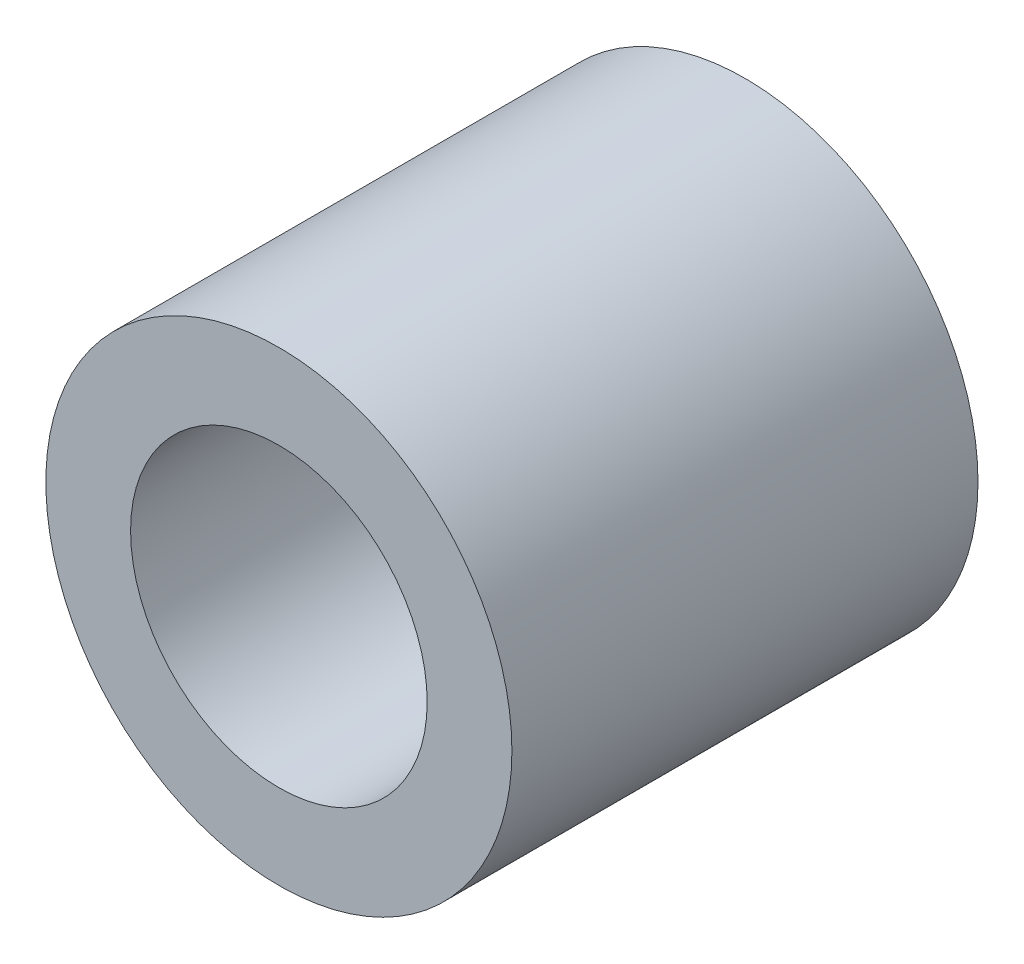
from build123d import *

# Parameters (mm, degrees)
SKETCH_1_R      = 2.75
SKETCH_1_R_2    = 1.75
EXTRUDE_1_DEPTH = 5.5


with BuildPart() as part:
    # 草图1 → 凸台-拉伸1 (new body)
    with BuildSketch(Plane.XY):
        Circle(SKETCH_1_R)
        Circle(SKETCH_1_R_2, mode=Mode.SUBTRACT)
    extrude(amount=EXTRUDE_1_DEPTH)


solid = part.part
